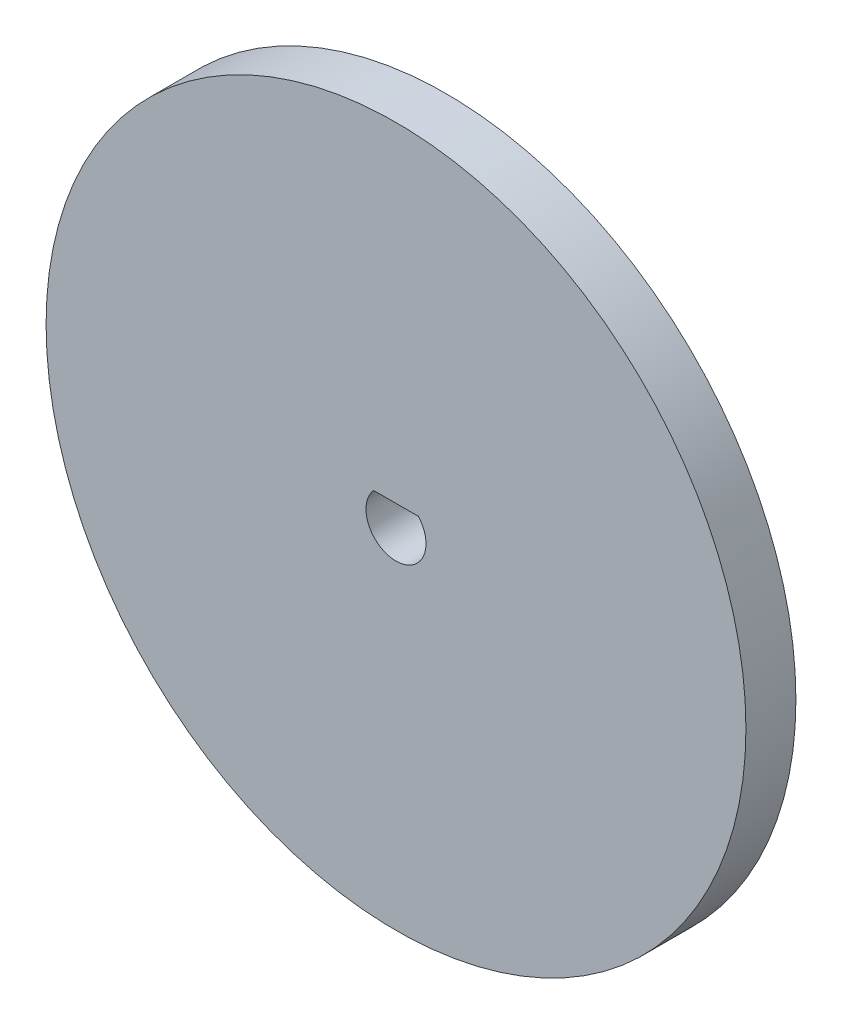
from build123d import *

# Parameters (mm, degrees)
ESBO_O1_R                = 17.5
RESSALTO_EXTRUS_O1_DEPTH = 2.5


with BuildPart() as part:
    # Esboço1 → Ressalto-extrusão1 (new body)
    with BuildSketch(Plane.XY):
        Circle(ESBO_O1_R)
        with BuildLine():
            Line((-1.12, 0.997797575), (1.12, 0.997797575))
            ThreePointArc((1.12, 0.997797575), (0, -1.5), (-1.12, 0.997797575))
        make_face(mode=Mode.SUBTRACT)
    extrude(amount=RESSALTO_EXTRUS_O1_DEPTH)


solid = part.part
